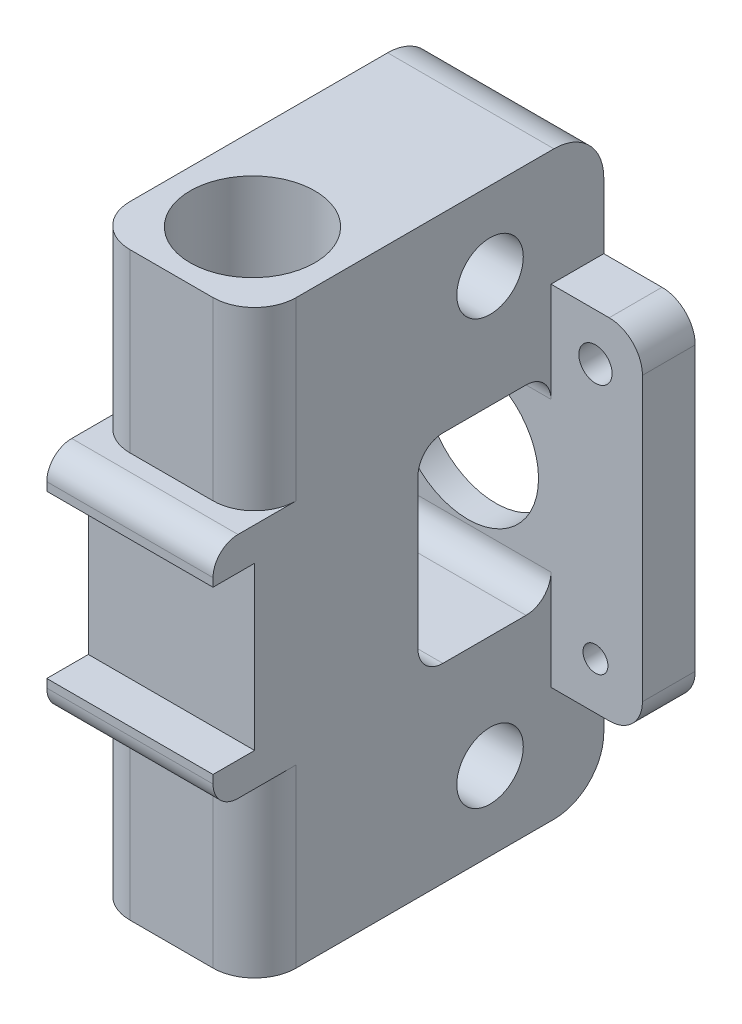
from build123d import *

# Parameters (mm, degrees)
SKETCH1_W           = 20
SKETCH1_H           = 42
BOSS_EXTRUDE1_DEPTH = 69.85
FILLET1_R           = 5
SKETCH3_W           = 42
SKETCH3_H           = 42
BOSS_EXTRUDE2_DEPTH = 6.35
SKETCH4_W           = 16
SKETCH4_H           = 24
CUT_EXTRUDE2_DEPTH  = 80.252902155
SKETCH5_R           = 13
CUT_EXTRUDE3_DEPTH  = 3
CUT_EXTRUDE4_REACH  = 84.71
SKETCH7_R           = 8.5
SKETCH8_R           = 4
CUT_EXTRUDE5_DEPTH  = 80.252902155
FILLET2_R           = 6
FILLET3_R           = 4
FILLET4_R           = 3
SKETCH9_W           = 20
SKETCH9_H           = 27.5
BOSS_EXTRUDE3_DEPTH = 6.35
SKETCH2_R           = 7.5
CUT_EXTRUDE1_DEPTH  = 76.901399855
SKETCH10_W          = 20
SKETCH10_H          = 4
BOSS_EXTRUDE4_DEPTH = 5
FILLET6_R           = 3
SKETCH11_R          = 2
SKETCH11_R_2        = 1.5
CUT_EXTRUDE6_DEPTH  = 7


with BuildPart() as part:
    # Sketch1 → Boss-Extrude1 (new body)
    with BuildSketch(Plane(origin=(0, 0, 0), x_dir=(1, 0, 0), z_dir=(0, 1, 0))):
        Rectangle(SKETCH1_W, SKETCH1_H)
    extrude(amount=BOSS_EXTRUDE1_DEPTH)

    # Fillet1
    fillet1_edges = [part.edges().sort_by_distance(p)[0] for p in [
        (10, 34.925, 21),
        (-10, 34.925, 21),
    ]]
    fillet(fillet1_edges, radius=FILLET1_R)

    # Sketch3 → Boss-Extrude2 (add)
    with BuildSketch(Plane(origin=(0, 0, -21), x_dir=(-1, 0, 0), z_dir=(0, 0, -1))):
        with Locations((0, 34.925)):
            Rectangle(SKETCH3_W, SKETCH3_H)
    extrude(amount=-BOSS_EXTRUDE2_DEPTH)

    # Sketch4 → Cut-Extrude2 (cut, through all)
    with BuildSketch(Plane(origin=(10, 0, 0), x_dir=(0, 0, -1), z_dir=(1, 0, 0))):
        with Locations((6.65, 34.925)):
            Rectangle(SKETCH4_W, SKETCH4_H)
    extrude(amount=-CUT_EXTRUDE2_DEPTH, mode=Mode.SUBTRACT)

    # Sketch5 → Cut-Extrude3 (cut)
    with BuildSketch(Plane(origin=(0, 0, -21), x_dir=(-1, 0, 0), z_dir=(0, 0, -1))):
        with Locations((0, 34.925)):
            Circle(SKETCH5_R)
    extrude(amount=-CUT_EXTRUDE3_DEPTH, mode=Mode.SUBTRACT)

    # Sketch7 → Cut-Extrude4 (cut, up to next)
    with BuildSketch(Plane(origin=(0, 0, -18), x_dir=(-1, 0, 0), z_dir=(0, 0, -1)), mode=Mode.PRIVATE) as cut_extrude4_sk1:
        with Locations((0, 34.925)):
            Circle(SKETCH7_R)
    cut_extrude4_tool1 = extrude(cut_extrude4_sk1.sketch, amount=-CUT_EXTRUDE4_REACH, mode=Mode.PRIVATE) & part.part
    add(cut_extrude4_tool1.solids().sort_by_distance((0, 34.925, -18))[0], mode=Mode.SUBTRACT)

    # Sketch8 → Cut-Extrude5 (cut, through all)
    with BuildSketch(Plane(origin=(10, 0, 0), x_dir=(0, 0, -1), z_dir=(1, 0, 0))):
        with Locations((7.318215362, 60.425)):
            Circle(SKETCH8_R)
        with Locations((7.318215362, 9.425)):
            Circle(SKETCH8_R)
    extrude(amount=-CUT_EXTRUDE5_DEPTH, mode=Mode.SUBTRACT)

    # Fillet2
    fillet2_edges = [part.edges().sort_by_distance(p)[0] for p in [
        (0, 0, -21),
        (0, 69.85, -21),
    ]]
    fillet(fillet2_edges, radius=FILLET2_R)

    # Fillet3
    fillet3_edges = [part.edges().sort_by_distance(p)[0] for p in [
        (-21, 13.925, -17.825),
        (21, 55.925, -17.825),
        (-21, 55.925, -17.825),
        (21, 13.925, -17.825),
    ]]
    fillet(fillet3_edges, radius=FILLET3_R)

    # Fillet4
    fillet4_edges = [part.edges().sort_by_distance(p)[0] for p in [
        (0, 22.925, 1.35),
        (0, 46.925, -14.65),
        (0, 46.925, 1.35),
        (0, 22.925, -14.65),
    ]]
    fillet(fillet4_edges, radius=FILLET4_R)

    # Sketch9 → Boss-Extrude3 (add)
    with BuildSketch(Plane.XY.offset(21)):
        with Locations((0, 34.925)):
            Rectangle(SKETCH9_W, SKETCH9_H)
    extrude(amount=-BOSS_EXTRUDE3_DEPTH)

    # Sketch2 → Cut-Extrude1 (cut, through all)
    with BuildSketch(Plane(origin=(0, 69.85, 0), x_dir=(1, 0, 0), z_dir=(0, 1, 0))):
        with Locations(Location((0, -11.254449914, 0), (0, 0, 270))):
            Circle(SKETCH2_R)
    extrude(amount=-CUT_EXTRUDE1_DEPTH, mode=Mode.SUBTRACT)

    # Sketch10 → Boss-Extrude4 (add)
    with BuildSketch(Plane.XY.offset(21)):
        with Locations((0, 23.175)):
            Rectangle(SKETCH10_W, SKETCH10_H)
        with Locations((0, 46.675)):
            Rectangle(SKETCH10_W, SKETCH10_H)
    extrude(amount=BOSS_EXTRUDE4_DEPTH)

    # Fillet6
    fillet6_edges = [part.edges().sort_by_distance(p)[0] for p in [
        (0, 21.175, 26),
        (0, 48.675, 26),
    ]]
    fillet(fillet6_edges, radius=FILLET6_R)

    # Sketch11 → Cut-Extrude6 (cut)
    with BuildSketch(Plane(origin=(85.430800997, 34.822301654, -21), x_dir=(-1, 0, 0), z_dir=(0, 0, -1))):
        with Locations((70.080800997, 15.452698346)):
            Circle(SKETCH11_R)
        with Locations(Location((100.780800997, -15.247301654, 0), (0, 0, 180))):
            Circle(SKETCH11_R_2)
        with Locations((70.080800997, -15.247301654)):
            Circle(SKETCH11_R_2)
        with Locations(Location((100.780800997, 15.452698346, 0), (0, 0, 180))):
            Circle(SKETCH11_R)
    extrude(amount=-CUT_EXTRUDE6_DEPTH, mode=Mode.SUBTRACT)


solid = part.part
